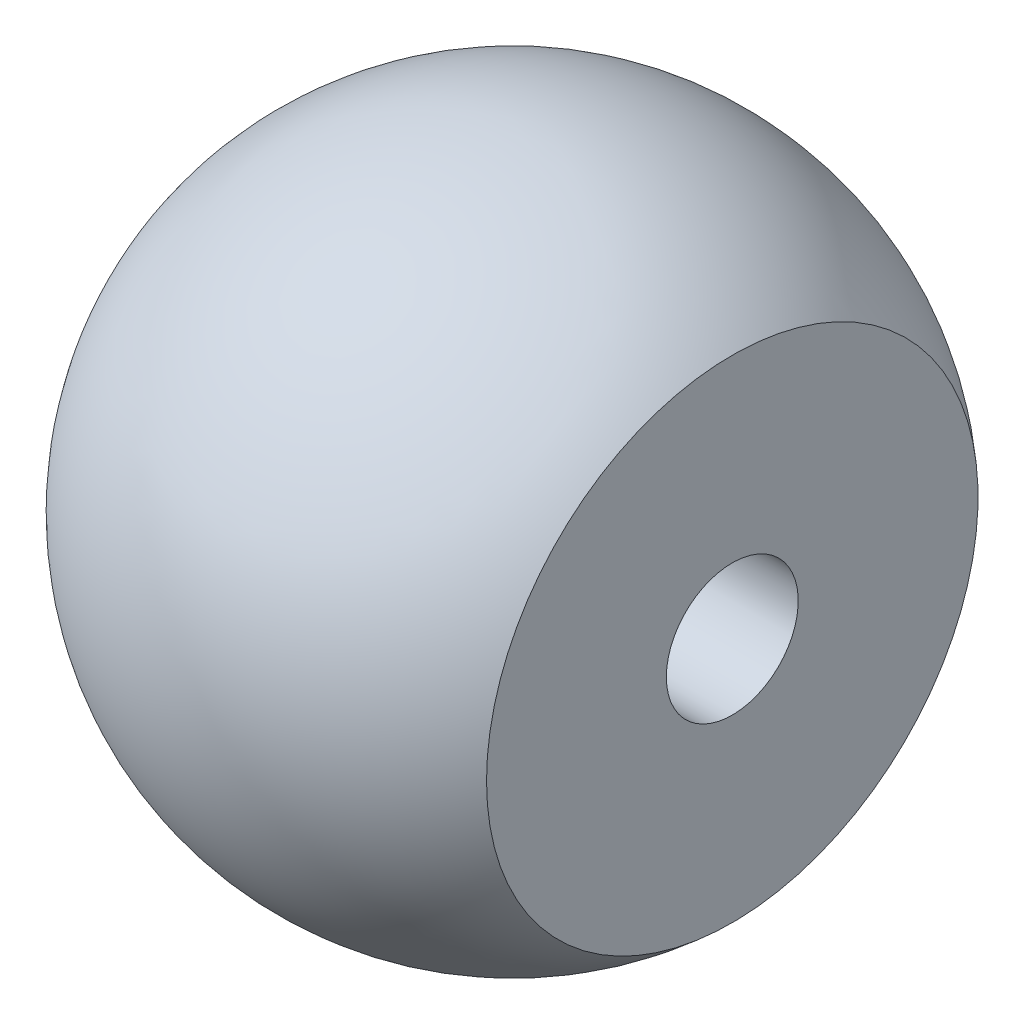
from build123d import *

# Parameters (mm, degrees)
CUT_EXTRUDE_THIN1_DEPTH      = 52.961524227
CUT_EXTRUDE_THIN1_DEPTH_BACK = 52.961524227
SKETCH2_W                    = 30
SKETCH2_H                    = 44.72135955
CUT_EXTRUDE1_DEPTH           = 66.574385243
CUT_EXTRUDE1_DEPTH_BACK      = 12
SKETCH3_R                    = 6


with BuildPart() as part:
    # Sketch1 → Revolve1 (revolve)
    with BuildSketch(Plane.XY):
        with BuildLine():
            Line((0, 30), (0, -30))
            ThreePointArc((0, -30), (30, 0), (0, 30))
        make_face()
    revolve(axis=Axis((0, 30, 0), (0, -1, 0)))

    # Sketch2 → Cut-Extrude-Thin1 (cut, two sides: drawn at the far end of the back side and taken through both)
    with BuildSketch(Plane.XY.offset(-CUT_EXTRUDE_THIN1_DEPTH_BACK)):
        with Locations((35, 0)):
            Rectangle(SKETCH2_W, SKETCH2_H)
    extrude(amount=CUT_EXTRUDE_THIN1_DEPTH + CUT_EXTRUDE_THIN1_DEPTH_BACK, mode=Mode.SUBTRACT)

    # Sketch3 → Cut-Extrude1 (cut, two sides: drawn at the far end of the back side and taken through both)
    with BuildSketch(Plane(origin=(20, 0, 0), x_dir=(0, 0, -1), z_dir=(1, 0, 0)).offset(-CUT_EXTRUDE1_DEPTH_BACK)):
        with Locations(Location((0, 0, 0), (0, 0, 180))):
            Circle(SKETCH3_R)
    extrude(amount=CUT_EXTRUDE1_DEPTH + CUT_EXTRUDE1_DEPTH_BACK, mode=Mode.SUBTRACT)


solid = part.part
